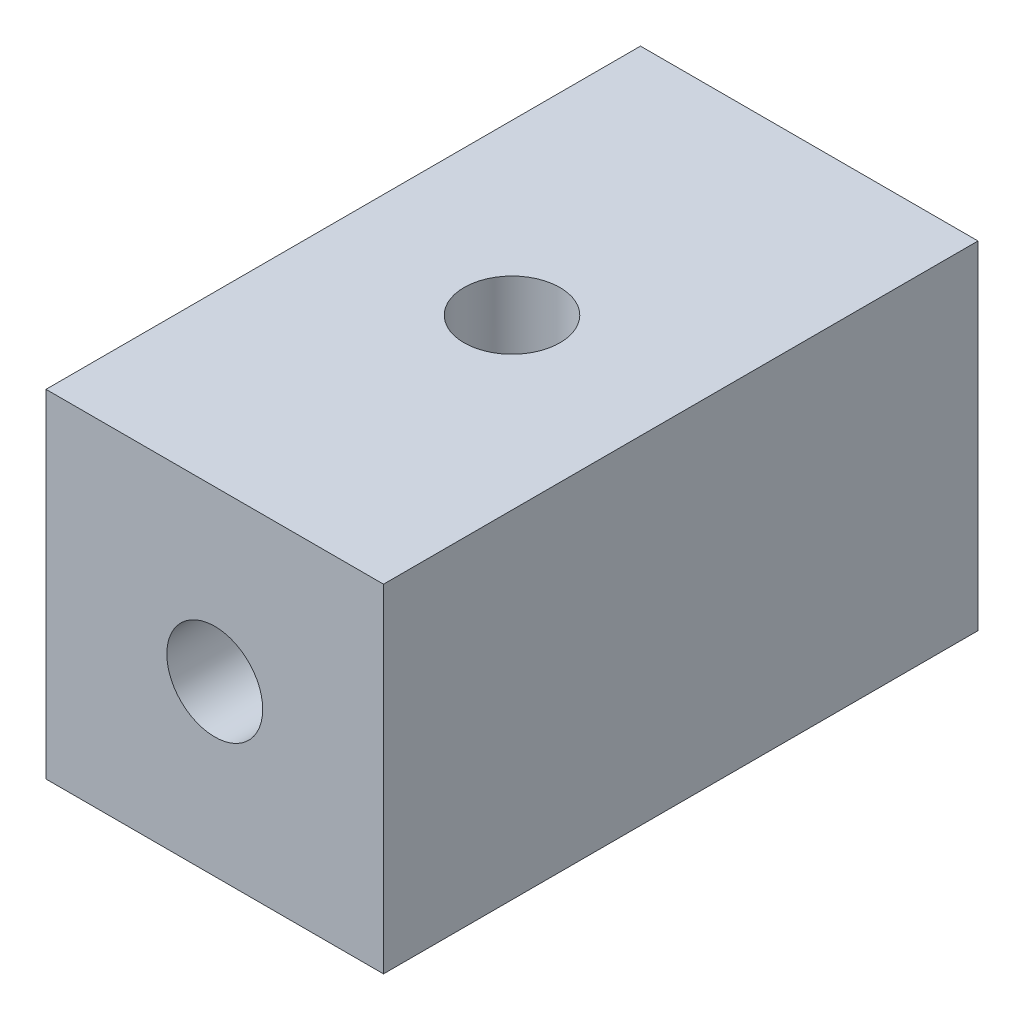
from build123d import *

# Parameters (mm, degrees)
SKETCH1_W           = 22.352
SKETCH1_H           = 22.352
SKETCH1_R           = 3.175
BOSS_EXTRUDE1_DEPTH = 39.37
SKETCH2_R           = 3.175
CUT_EXTRUDE1_DEPTH  = 25.4


with BuildPart() as part:
    # Sketch1 → Boss-Extrude1 (new body)
    with BuildSketch(Plane.XY):
        Rectangle(SKETCH1_W, SKETCH1_H)
        Circle(SKETCH1_R, mode=Mode.SUBTRACT)
    extrude(amount=BOSS_EXTRUDE1_DEPTH)

    # Sketch2 → Cut-Extrude1 (cut)
    with BuildSketch(Plane(origin=(0, 11.176, 0), x_dir=(1, 0, 0), z_dir=(0, 1, 0))):
        with Locations(Location((0, -19.685, 0), (0, 0, 270))):
            Circle(SKETCH2_R)
    extrude(amount=-CUT_EXTRUDE1_DEPTH, mode=Mode.SUBTRACT)


solid = part.part
